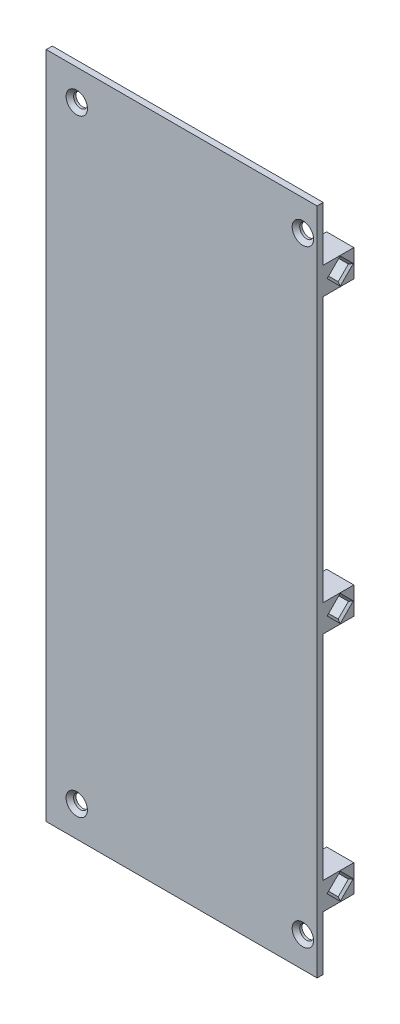
from build123d import *

# Parameters (mm, degrees)
SKETCH1_W                      = 84.401025
SKETCH1_H                      = 208.28
BOSS_EXTRUDE1_DEPTH            = 1.905
F_6_CLEARANCE_HOLE1_AT_2_COUNT = 2
F_6_CLEARANCE_HOLE1_AT_2_PITCH = 189.23
F_6_CLEARANCE_HOLE1_AT_3_COUNT = 2
F_6_CLEARANCE_HOLE1_AT_3_PITCH = 201.912164523
F_6_CLEARANCE_HOLE1_AT_4_COUNT = 2
F_6_CLEARANCE_HOLE1_AT_4_PITCH = 70.431025
SKETCH4_W                      = 8.466667
SKETCH4_H                      = 8.466667
BOSS_EXTRUDE2_DEPTH            = 9.525
CUT_EXTRUDE3_DEPTH             = 6.35
CHAMFER1_SIZE                  = 0.635


with BuildPart() as part:
    # Sketch1 → Boss-Extrude1 (new body)
    with BuildSketch(Plane.XY):
        Rectangle(SKETCH1_W, SKETCH1_H)
    extrude(amount=BOSS_EXTRUDE1_DEPTH)

    # Sketch3 → #6 Clearance Hole1 (revolve, cut)
    with BuildSketch(Plane(origin=(-32.6755125, 94.615, 1.905), x_dir=(0, -1, 0), z_dir=(1, 0, 0))):
        Polygon((0, 0), (0, 1.905), (2.15265, 1.905), (2.15265, 1.17475), (3.3274, 0), align=None)
    f_6_clearance_hole1 = revolve(axis=Axis((-32.6755125, 94.615, 8.255), (0, 0, -1)), mode=Mode.SUBTRACT)

    # #6 Clearance Hole1 at 2: #6 Clearance Hole1 ×2
    with Locations(*[(0, -i * F_6_CLEARANCE_HOLE1_AT_2_PITCH, 0) for i in range(1, F_6_CLEARANCE_HOLE1_AT_2_COUNT)]):
        add(f_6_clearance_hole1, mode=Mode.SUBTRACT)

    # #6 Clearance Hole1 at 3: #6 Clearance Hole1 ×2
    with Locations(*[Vector(0.34882011772903904, -0.9371896955619494, 0) * (i * F_6_CLEARANCE_HOLE1_AT_3_PITCH) for i in range(1, F_6_CLEARANCE_HOLE1_AT_3_COUNT)]):
        add(f_6_clearance_hole1, mode=Mode.SUBTRACT)

    # #6 Clearance Hole1 at 4: #6 Clearance Hole1 ×2
    with Locations(*[(i * F_6_CLEARANCE_HOLE1_AT_4_PITCH, 0, 0) for i in range(1, F_6_CLEARANCE_HOLE1_AT_4_COUNT)]):
        add(f_6_clearance_hole1, mode=Mode.SUBTRACT)

    # Sketch4 → Boss-Extrude2 (add)
    with BuildSketch(Plane(origin=(0, 0, 0), x_dir=(-1, 0, 0), z_dir=(0, 0, -1))):
        with Locations((-37.967179, 82.973333082)):
            Rectangle(SKETCH4_W, SKETCH4_H)
        with Locations((-37.967179, -8.0433335)):
            Rectangle(SKETCH4_W, SKETCH4_H)
        with Locations((-37.967179, -82.973333082)):
            Rectangle(SKETCH4_W, SKETCH4_H)
    extrude(amount=BOSS_EXTRUDE2_DEPTH)

    # Sketch5 → Cut-Extrude3 (cut)
    with BuildSketch(Plane(origin=(42.2005125, 0, 0), x_dir=(0, 0, -1), z_dir=(1, 0, 0))):
        Polygon((2.116666667, -82.973333082), (5.291666667, -79.798333082), (8.466666667, -82.973333082), (5.291666667, -86.148333082), align=None)
        Polygon((2.116666667, -8.0433335), (5.291666667, -4.8683335), (8.466666667, -8.0433335), (5.291666667, -11.2183335), align=None)
        Polygon((2.116666667, 82.973333082), (5.291666667, 86.148333082), (8.466666667, 82.973333082), (5.291666667, 79.798333082), align=None)
    extrude(amount=-CUT_EXTRUDE3_DEPTH, mode=Mode.SUBTRACT)

    # Chamfer1
    chamfer1_edges = [part.edges().sort_by_distance(p)[0] for p in [
        (35.8505125, 81.385833082, -3.704166667),
        (35.8505125, 84.560833082, -3.704166667),
        (35.8505125, 84.560833082, -6.879166667),
        (35.8505125, 81.385833082, -6.879166667),
        (42.2005125, 81.385833082, -3.704166667),
        (42.2005125, 81.385833082, -6.879166667),
        (42.2005125, 84.560833082, -6.879166667),
        (42.2005125, 84.560833082, -3.704166667),
        (35.8505125, -84.560833082, -3.704166667),
        (35.8505125, -81.385833082, -3.704166667),
        (35.8505125, -81.385833082, -6.879166667),
        (35.8505125, -84.560833082, -6.879166667),
        (42.2005125, -84.560833082, -3.704166667),
        (42.2005125, -84.560833082, -6.879166667),
        (42.2005125, -81.385833082, -6.879166667),
        (42.2005125, -81.385833082, -3.704166667),
        (42.2005125, -9.6308335, -3.704166667),
        (42.2005125, -9.6308335, -6.879166667),
        (42.2005125, -6.4558335, -6.879166667),
        (42.2005125, -6.4558335, -3.704166667),
    ]]
    chamfer(chamfer1_edges, length=CHAMFER1_SIZE)


solid = part.part
